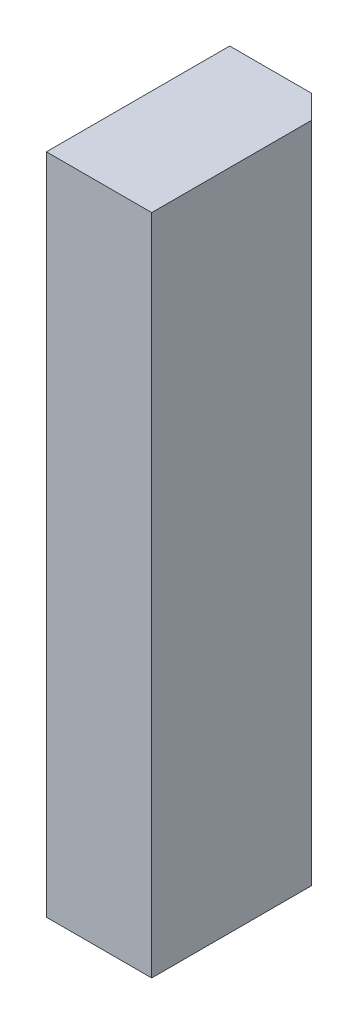
from build123d import *

# Parameters (mm, degrees)
SKETCH_1_W          = 2.7
SKETCH_1_H          = 4.7
EXTRUDE_1_DEPTH     = 17
CHAMFER_1_SIZE      = 0.6
CUT_EXTRUDE_2_REACH = 19.373
SKETCH_3_R          = 0.5


with BuildPart() as part:
    # 草圖1 → 伸長1 (new body)
    with BuildSketch(Plane(origin=(0, 0, 0), x_dir=(1, 0, 0), z_dir=(0, 1, 0))):
        Rectangle(SKETCH_1_W, SKETCH_1_H)
    extrude(amount=EXTRUDE_1_DEPTH)

    # 導角1
    chamfer_1_edges = [part.edges().sort_by_distance(p)[0] for p in [
        (1.35, 8.5, -2.35),
    ]]
    chamfer(chamfer_1_edges, length=CHAMFER_1_SIZE)

    # 伸長2: up to this plane
    cut_extrude_2_end = Plane(origin=(0.75, 17, -2.35), z_dir=(-0.7071067811865486, 0, 0.7071067811865466))
    # 草圖3 → 伸長2 (cut, up to the surface)
    with BuildSketch(Plane.ZY.offset(1.35), mode=Mode.PRIVATE) as cut_extrude_2_sk1:
        with Locations((-2.45, 1)):
            Circle(SKETCH_3_R)
    cut_extrude_2_tool1 = split(extrude(cut_extrude_2_sk1.sketch, amount=-CUT_EXTRUDE_2_REACH, mode=Mode.PRIVATE), bisect_by=cut_extrude_2_end, keep=Keep.BOTH, mode=Mode.PRIVATE)
    add(cut_extrude_2_tool1.solids().sort_by_distance((-1.35, 1, -2.45))[0], mode=Mode.SUBTRACT)


solid = part.part
